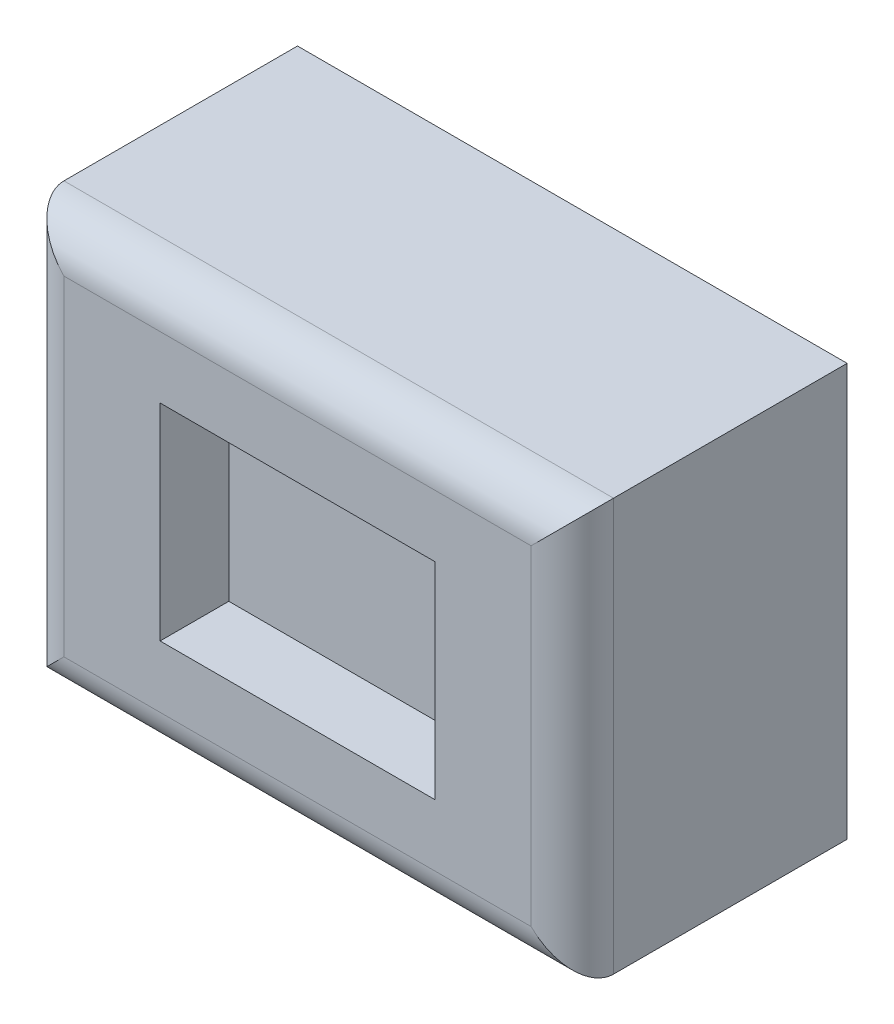
from build123d import *

# Parameters (mm, degrees)
SKETCH_1_W      = 40
SKETCH_1_H      = 30
M0_BOSS_DEPTH   = 20
SKETCH_2_W      = 20
SKETCH_2_H      = 15
M0_POCKET_DEPTH = 5
M0_TOPR3_R      = 3


with BuildPart() as part:
    # ｽｹｯﾁ1 → M0_Boss (new body)
    with BuildSketch(Plane.XY):
        Rectangle(SKETCH_1_W, SKETCH_1_H)
    extrude(amount=M0_BOSS_DEPTH)

    # ｽｹｯﾁ2 → M0_Pocket (cut)
    with BuildSketch(Plane.XY.offset(20)):
        Rectangle(SKETCH_2_W, SKETCH_2_H)
    extrude(amount=-M0_POCKET_DEPTH, mode=Mode.SUBTRACT)

    # M0_TopR3
    m0_topr3_edges = [part.edges().sort_by_distance(p)[0] for p in [
        (20, 0, 20),
        (0, 15, 20),
        (-20, 0, 20),
        (0, -15, 20),
    ]]
    fillet(m0_topr3_edges, radius=M0_TOPR3_R)


solid = part.part
